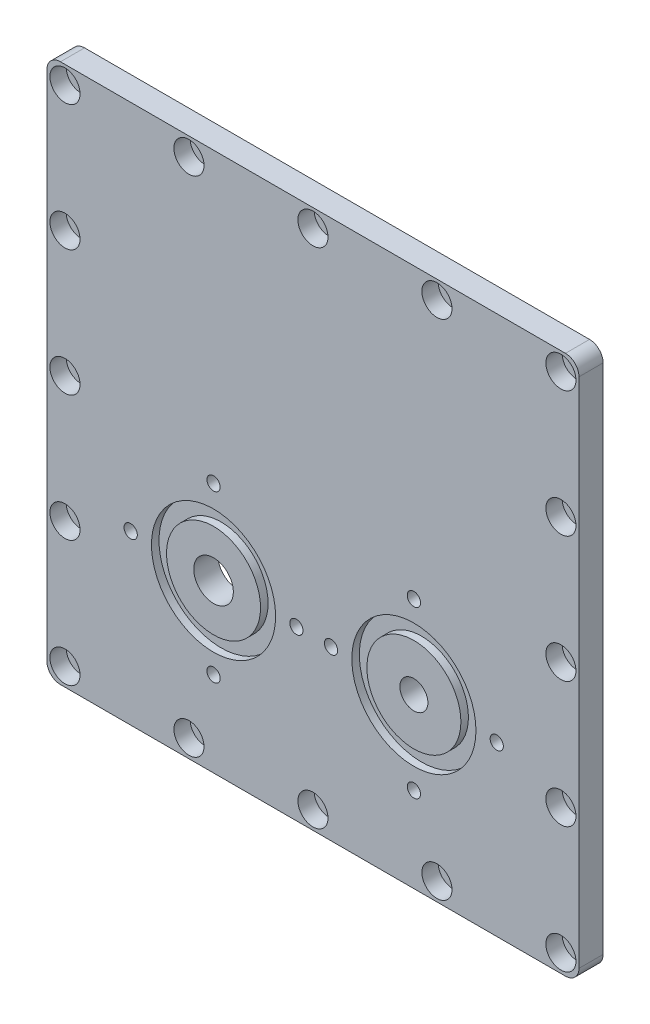
from build123d import *

# Parameters (mm, degrees)
BOSS_EXTRUDE1_DEPTH = 8
CUT_EXTRUDE1_DEPTH  = 90
SKETCH3_R           = 5
CUT_EXTRUDE2_DEPTH  = 5.4
SKETCH5_R           = 2.2
SKETCH5_R_2         = 4.65
CUT_EXTRUDE3_DEPTH  = 20
SKETCH6_R           = 20.6
SKETCH6_R_2         = 15.6
CUT_EXTRUDE4_DEPTH  = 2.5
SKETCH7_R           = 20.6
SKETCH7_R_2         = 15.6
CUT_EXTRUDE5_DEPTH  = 2.5
CUT_EXTRUDE6_REACH  = 127.974
SKETCH9_R           = 2.2
SKETCH9_R_2         = 6.575


with BuildPart() as part:
    # Sketch1 → Boss-Extrude1 (new body)
    with BuildSketch(Plane.XY):
        with BuildLine():
            Line((-83.790627288, -89.5), (83.790627288, -89.5))
            ThreePointArc((83.790627288, -89.5), (86.972607803, -88.181980515), (88.290627288, -85))
            Line((88.290627288, -85), (88.290627288, 85))
            ThreePointArc((88.290627288, 85), (86.972607803, 88.181980515), (83.790627288, 89.5))
            Line((83.790627288, 89.5), (-83.790627288, 89.5))
            ThreePointArc((-83.790627288, 89.5), (-86.972607803, 88.181980515), (-88.290627288, 85))
            Line((-88.290627288, 85), (-88.290627288, -85))
            ThreePointArc((-88.290627288, -85), (-86.972607803, -88.181980515), (-83.790627288, -89.5))
        make_face()
    extrude(amount=BOSS_EXTRUDE1_DEPTH)

    # Sketch2 → Cut-Extrude1 (cut)
    with BuildSketch(Plane.XY.offset(8)):
        with BuildLine():
            ThreePointArc((43.745313644, 83.5), (41.145313644, 86.1), (38.545313644, 83.5))
            ThreePointArc((38.545313644, 83.5), (41.145313644, 80.9), (43.745313644, 83.5))
        make_face()
        with BuildLine():
            Line((0, 84), (2.551470164, 84))
            ThreePointArc((2.551470164, 84), (0, 86.1), (-2.551470164, 84))
            Line((-2.551470164, 84), (0, 84))
        make_face()
        with BuildLine():
            Line((0, 84), (-2.551470164, 84))
            ThreePointArc((-2.551470164, 84), (0, 80.9), (2.551470164, 84))
            Line((2.551470164, 84), (0, 84))
        make_face()
        with BuildLine():
            ThreePointArc((-43.745313644, 83.5), (-41.145313644, 80.9), (-38.545313644, 83.5))
            ThreePointArc((-38.545313644, 83.5), (-41.145313644, 86.1), (-43.745313644, 83.5))
        make_face()
        with BuildLine():
            ThreePointArc((-84.890627288, 83.5), (-82.290627288, 80.9), (-79.690627288, 83.5))
            ThreePointArc((-79.690627288, 83.5), (-82.290627288, 86.1), (-84.890627288, 83.5))
        make_face()
        with BuildLine():
            ThreePointArc((-84.890627288, 41.75), (-82.290627288, 39.15), (-79.690627288, 41.75))
            ThreePointArc((-79.690627288, 41.75), (-82.290627288, 44.35), (-84.890627288, 41.75))
        make_face()
        with BuildLine():
            ThreePointArc((-84.890627288, 0), (-82.290627288, -2.6), (-79.690627288, 0))
            ThreePointArc((-79.690627288, 0), (-82.290627288, 2.6), (-84.890627288, 0))
        make_face()
        with BuildLine():
            ThreePointArc((-79.690627288, -83.5), (-82.290627288, -80.9), (-84.890627288, -83.5))
            ThreePointArc((-84.890627288, -83.5), (-82.290627288, -86.1), (-79.690627288, -83.5))
        make_face()
        with BuildLine():
            ThreePointArc((-84.890627288, -41.75), (-82.290627288, -44.35), (-79.690627288, -41.75))
            ThreePointArc((-79.690627288, -41.75), (-82.290627288, -39.15), (-84.890627288, -41.75))
        make_face()
        with BuildLine():
            ThreePointArc((-43.745313644, -83.5), (-41.145313644, -86.1), (-38.545313644, -83.5))
            ThreePointArc((-38.545313644, -83.5), (-41.145313644, -80.9), (-43.745313644, -83.5))
        make_face()
        with BuildLine():
            ThreePointArc((-2.6, -83.5), (0, -86.1), (2.6, -83.5))
            ThreePointArc((2.6, -83.5), (0, -80.9), (-2.6, -83.5))
        make_face()
        with BuildLine():
            ThreePointArc((38.545313644, -83.5), (41.145313644, -86.1), (43.745313644, -83.5))
            ThreePointArc((43.745313644, -83.5), (41.145313644, -80.9), (38.545313644, -83.5))
        make_face()
        with BuildLine():
            ThreePointArc((79.690627288, -83.5), (82.290627288, -86.1), (84.890627288, -83.5))
            ThreePointArc((84.890627288, -83.5), (82.290627288, -80.9), (79.690627288, -83.5))
        make_face()
        with BuildLine():
            ThreePointArc((79.690627288, -41.75), (82.290627288, -44.35), (84.890627288, -41.75))
            ThreePointArc((84.890627288, -41.75), (82.290627288, -39.15), (79.690627288, -41.75))
        make_face()
        with BuildLine():
            ThreePointArc((79.690627288, 0), (82.290627288, -2.6), (84.890627288, 0))
            ThreePointArc((84.890627288, 0), (82.290627288, 2.6), (79.690627288, 0))
        make_face()
        with BuildLine():
            ThreePointArc((79.690627288, 41.75), (82.290627288, 39.15), (84.890627288, 41.75))
            ThreePointArc((84.890627288, 41.75), (82.290627288, 44.35), (79.690627288, 41.75))
        make_face()
        with BuildLine():
            ThreePointArc((79.690627288, 83.5), (82.290627288, 80.9), (84.890627288, 83.5))
            ThreePointArc((84.890627288, 83.5), (82.290627288, 86.1), (79.690627288, 83.5))
        make_face()
    extrude(amount=-CUT_EXTRUDE1_DEPTH, mode=Mode.SUBTRACT)

    # Sketch3 → Cut-Extrude2 (cut)
    with BuildSketch(Plane.XY.offset(8)):
        with Locations((41.145313644, 83.5)):
            Circle(SKETCH3_R)
        with Locations((82.290627288, 83.5)):
            Circle(SKETCH3_R)
        with Locations((82.290627288, 41.75)):
            Circle(SKETCH3_R)
        with Locations((82.290627288, 0)):
            Circle(SKETCH3_R)
        with Locations((82.290627288, -41.75)):
            Circle(SKETCH3_R)
        with Locations((82.290627288, -83.5)):
            Circle(SKETCH3_R)
        with Locations((41.145313644, -83.5)):
            Circle(SKETCH3_R)
        with Locations((0, -83.5)):
            Circle(SKETCH3_R)
        with Locations((-82.290627288, 0)):
            Circle(SKETCH3_R)
        with Locations((-82.290627288, -83.5)):
            Circle(SKETCH3_R)
        with Locations((-82.290627288, -41.75)):
            Circle(SKETCH3_R)
        with Locations((-41.145313644, -83.5)):
            Circle(SKETCH3_R)
        with Locations((-82.290627288, 41.75)):
            Circle(SKETCH3_R)
        with Locations((-82.290627288, 83.5)):
            Circle(SKETCH3_R)
        with Locations((-41.145313644, 83.5)):
            Circle(SKETCH3_R)
        with Locations((0, 83.5)):
            Circle(SKETCH3_R)
    extrude(amount=-CUT_EXTRUDE2_DEPTH, mode=Mode.SUBTRACT)

    # Sketch5 → Cut-Extrude3 (cut)
    with BuildSketch(Plane.XY.offset(8)):
        with Locations((33.49662103, -6.254772237)):
            Circle(SKETCH5_R)
        with Locations((5.99662103, -33.754772237)):
            Circle(SKETCH5_R)
        with Locations((33.49662103, -61.254772237)):
            Circle(SKETCH5_R)
        with Locations((60.99662103, -33.754772237)):
            Circle(SKETCH5_R)
        with Locations((33.49662103, -33.754772237)):
            Circle(SKETCH5_R_2)
    extrude(amount=-CUT_EXTRUDE3_DEPTH, mode=Mode.SUBTRACT)

    # Sketch6 → Cut-Extrude4 (cut)
    with BuildSketch(Plane.XY.offset(8)):
        with Locations((33.49662103, -33.754772237)):
            Circle(SKETCH6_R)
        with Locations((33.49662103, -33.754772237)):
            Circle(SKETCH6_R_2, mode=Mode.SUBTRACT)
    extrude(amount=-CUT_EXTRUDE4_DEPTH, mode=Mode.SUBTRACT)

    # Sketch7 → Cut-Extrude5 (cut)
    with BuildSketch(Plane.XY.offset(8)):
        with Locations((-32.990627288, -34.2)):
            Circle(SKETCH7_R)
        with Locations((-32.990627288, -34.2)):
            Circle(SKETCH7_R_2, mode=Mode.SUBTRACT)
    extrude(amount=-CUT_EXTRUDE5_DEPTH, mode=Mode.SUBTRACT)

    # Sketch9 → Cut-Extrude6 (cut, up to next)
    with BuildSketch(Plane.XY.offset(8), mode=Mode.PRIVATE) as cut_extrude6_sk1:
        with Locations((-5.490627288, -33.754772237)):
            Circle(SKETCH9_R)
    cut_extrude6_tool1 = extrude(cut_extrude6_sk1.sketch, amount=-CUT_EXTRUDE6_REACH, mode=Mode.PRIVATE) & part.part
    # Sketch9 → Cut-Extrude6 (cut, up to next)
    with BuildSketch(Plane.XY.offset(8), mode=Mode.PRIVATE) as cut_extrude6_sk2:
        with Locations((-32.990627288, -6.254772237)):
            Circle(SKETCH9_R)
    cut_extrude6_tool2 = extrude(cut_extrude6_sk2.sketch, amount=-CUT_EXTRUDE6_REACH, mode=Mode.PRIVATE) & part.part
    # Sketch9 → Cut-Extrude6 (cut, up to next)
    with BuildSketch(Plane.XY.offset(8), mode=Mode.PRIVATE) as cut_extrude6_sk3:
        with Locations((-32.990627288, -61.254772237)):
            Circle(SKETCH9_R)
    cut_extrude6_tool3 = extrude(cut_extrude6_sk3.sketch, amount=-CUT_EXTRUDE6_REACH, mode=Mode.PRIVATE) & part.part
    # Sketch9 → Cut-Extrude6 (cut, up to next)
    with BuildSketch(Plane.XY.offset(8), mode=Mode.PRIVATE) as cut_extrude6_sk4:
        with Locations((-32.990627288, -34.2)):
            Circle(SKETCH9_R_2)
    cut_extrude6_tool4 = extrude(cut_extrude6_sk4.sketch, amount=-CUT_EXTRUDE6_REACH, mode=Mode.PRIVATE) & part.part
    # Sketch9 → Cut-Extrude6 (cut, up to next)
    with BuildSketch(Plane.XY.offset(8), mode=Mode.PRIVATE) as cut_extrude6_sk5:
        with Locations((-60.490627288, -33.754772237)):
            Circle(SKETCH9_R)
    cut_extrude6_tool5 = extrude(cut_extrude6_sk5.sketch, amount=-CUT_EXTRUDE6_REACH, mode=Mode.PRIVATE) & part.part
    add(cut_extrude6_tool1.solids().sort_by_distance((-5.490627, -33.754772, 8))[0], mode=Mode.SUBTRACT)
    add(cut_extrude6_tool2.solids().sort_by_distance((-32.990627, -6.254772, 8))[0], mode=Mode.SUBTRACT)
    add(cut_extrude6_tool3.solids().sort_by_distance((-32.990627, -61.254772, 8))[0], mode=Mode.SUBTRACT)
    add(cut_extrude6_tool4.solids().sort_by_distance((-32.990627, -34.2, 8))[0], mode=Mode.SUBTRACT)
    add(cut_extrude6_tool5.solids().sort_by_distance((-60.490627, -33.754772, 8))[0], mode=Mode.SUBTRACT)


solid = part.part
